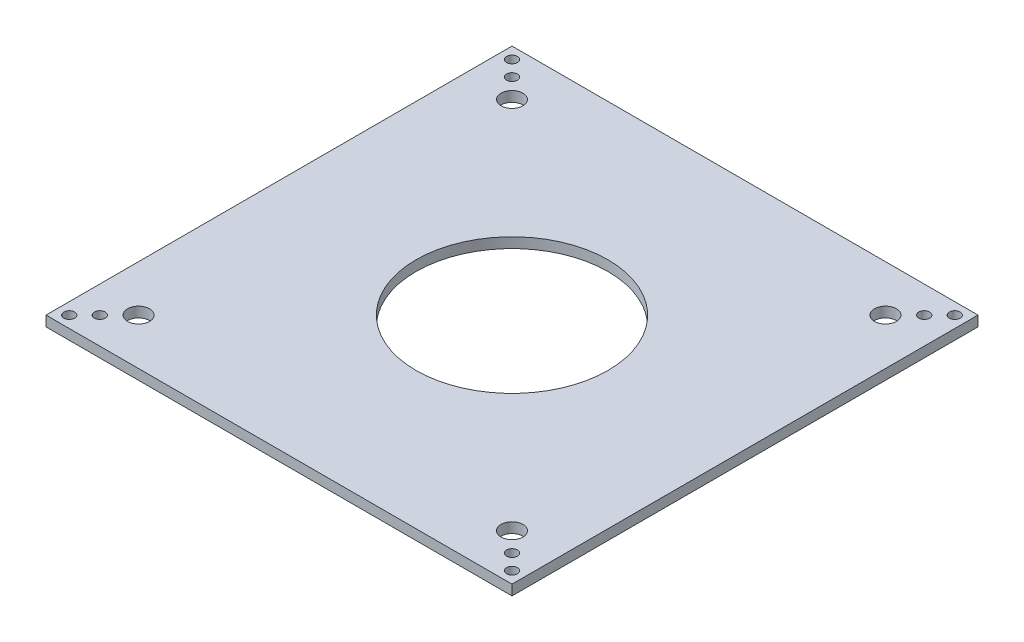
from build123d import *

# Parameters (mm, degrees)
SKETCH1_W           = 215.9
SKETCH1_H           = 215.9
SKETCH1_R           = 2.5
SKETCH1_R_2         = 5.08
SKETCH1_R_3         = 44.45
BOSS_EXTRUDE1_DEPTH = 4.7498


with BuildPart() as part:
    # Sketch1 → Boss-Extrude1 (new body)
    with BuildSketch(Plane(origin=(0, 0, 0), x_dir=(1, 0, 0), z_dir=(0, 1, 0))):
        Rectangle(SKETCH1_W, SKETCH1_H)
        with Locations(Location((95.490778515, -95.490778515, 0), (0, 0, 270))):
            Circle(SKETCH1_R, mode=Mode.SUBTRACT)
        with Locations(Location((102.561846327, -102.561846327, 0), (0, 0, 270))):
            Circle(SKETCH1_R, mode=Mode.SUBTRACT)
        with Locations(Location((-95.490778515, -95.490778515, 0), (0, 0, 270))):
            Circle(SKETCH1_R, mode=Mode.SUBTRACT)
        with Locations(Location((-102.561846327, -102.561846327, 0), (0, 0, 270))):
            Circle(SKETCH1_R, mode=Mode.SUBTRACT)
        with Locations(Location((-95.490778515, 95.490778515, 0), (0, 0, 270))):
            Circle(SKETCH1_R, mode=Mode.SUBTRACT)
        with Locations(Location((-102.561846327, 102.561846327, 0), (0, 0, 270))):
            Circle(SKETCH1_R, mode=Mode.SUBTRACT)
        with Locations(Location((95.490778515, 95.490778515, 0), (0, 0, 270))):
            Circle(SKETCH1_R, mode=Mode.SUBTRACT)
        with Locations(Location((102.561846327, 102.561846327, 0), (0, 0, 270))):
            Circle(SKETCH1_R, mode=Mode.SUBTRACT)
        with Locations(Location((86.510522394, -86.510522394, 0), (0, 0, 270))):
            Circle(SKETCH1_R_2, mode=Mode.SUBTRACT)
        with Locations(Location((-86.510522394, -86.510522394, 0), (0, 0, 270))):
            Circle(SKETCH1_R_2, mode=Mode.SUBTRACT)
        with Locations(Location((-86.510522394, 86.510522394, 0), (0, 0, 270))):
            Circle(SKETCH1_R_2, mode=Mode.SUBTRACT)
        with Locations(Location((86.510522394, 86.510522394, 0), (0, 0, 270))):
            Circle(SKETCH1_R_2, mode=Mode.SUBTRACT)
        with Locations(Location((0, 0, 0), (0, 0, 270))):
            Circle(SKETCH1_R_3, mode=Mode.SUBTRACT)
    extrude(amount=BOSS_EXTRUDE1_DEPTH)


solid = part.part
